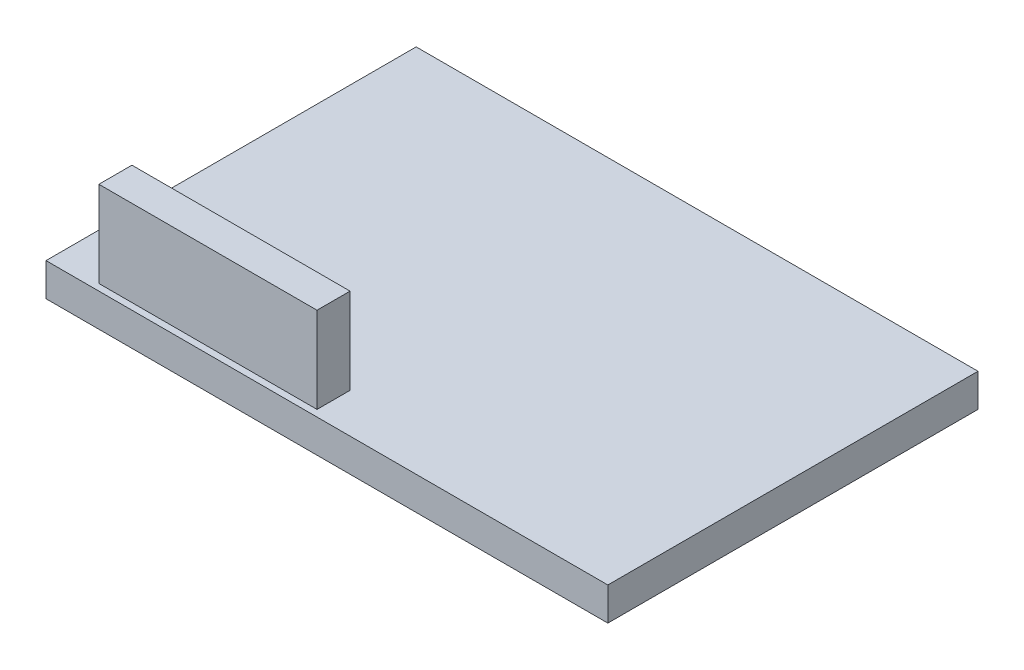
from build123d import *

# Parameters (mm, degrees)
SKETCH_1_W          = 85
SKETCH_1_H          = 56
EXTRUDE_1_DEPTH     = 5
SKETCH_2_W          = 33
SKETCH_2_H          = 5
EXTRUDE_2_DEPTH     = 13
SKETCH_3_W          = 70
SKETCH_3_H          = 51
SKETCH_3_W_2        = 68
SKETCH_3_H_2        = 49
CUT_EXTRUDE_1_DEPTH = 1


with BuildPart() as part:
    # Эскиз1 → Бобышка-Вытянуть1 (new body)
    with BuildSketch(Plane(origin=(0, 0, 0), x_dir=(1, 0, 0), z_dir=(0, 1, 0))):
        with Locations((42.5, 28)):
            Rectangle(SKETCH_1_W, SKETCH_1_H)
    extrude(amount=EXTRUDE_1_DEPTH)

    # Эскиз2 → Бобышка-Вытянуть2 (add)
    with BuildSketch(Plane(origin=(0, 5, 0), x_dir=(1, 0, 0), z_dir=(0, 1, 0))):
        with Locations((23.5, 3.5)):
            Rectangle(SKETCH_2_W, SKETCH_2_H)
    extrude(amount=EXTRUDE_2_DEPTH)

    # Эскиз3 → Вырез-Вытянуть-Тонкостенный1 (cut)
    with BuildSketch(Plane.XZ):
        with Locations((41.5, -29)):
            Rectangle(SKETCH_3_W, SKETCH_3_H)
        with Locations((41.5, -29)):
            Rectangle(SKETCH_3_W_2, SKETCH_3_H_2, mode=Mode.SUBTRACT)
    extrude(amount=-CUT_EXTRUDE_1_DEPTH, mode=Mode.SUBTRACT)


solid = part.part
